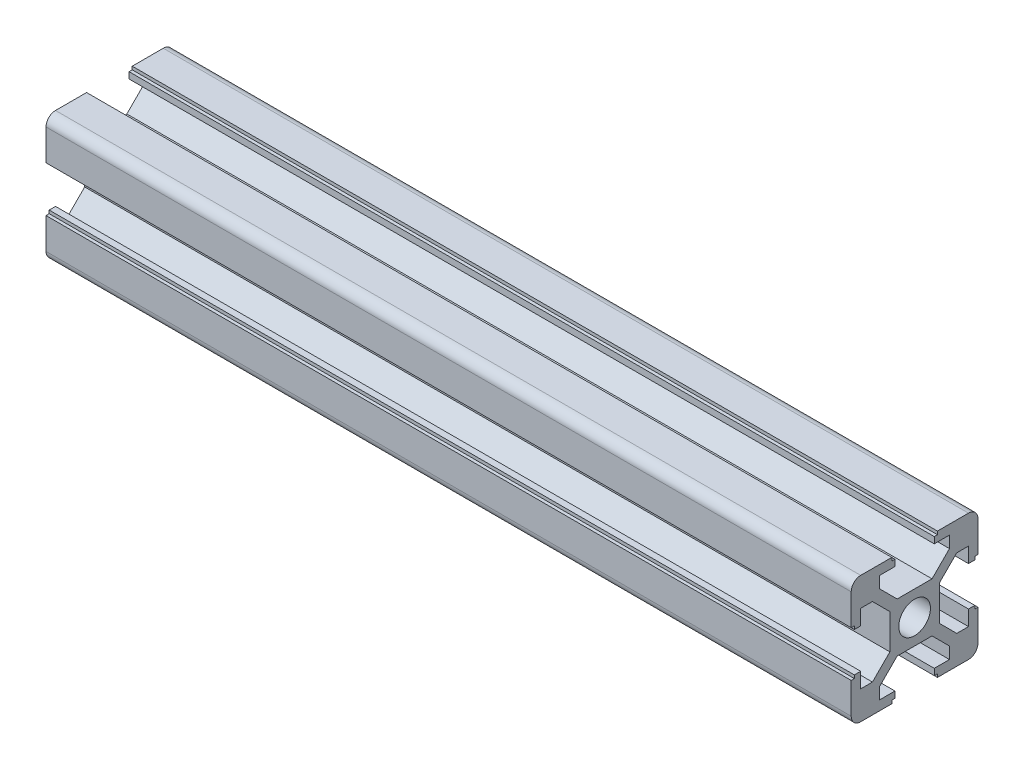
from build123d import *

# Parameters (mm, degrees)
SKETCH1_R                = 2.5
F_20_X_20_X_R1_5_1_DEPTH = 127


with BuildPart() as part:
    # Sketch1 → 铝型材 20 X 20 X R1.5(1) (new body)
    with BuildSketch(Plane(origin=(0, 0, 0), x_dir=(0, 0, -1), z_dir=(1, 0, 0))):
        with BuildLine():
            Line((-3.6, 10), (-3.6, 9.5))
            Line((-3.6, 9.5), (-3.1, 9.5))
            Line((-3.1, 9.5), (-3.1, 8.5))
            Line((-3.1, 8.5), (-5.5, 8.5))
            Line((-5.5, 8.5), (-5.5, 6.65))
            Line((-5.5, 6.65), (-2.75, 3.9))
            Line((-2.75, 3.9), (2.75, 3.9))
            Line((2.75, 3.9), (5.5, 6.65))
            Line((5.5, 6.65), (5.5, 8.5))
            Line((5.5, 8.5), (3.1, 8.5))
            Line((3.1, 8.5), (3.1, 9.5))
            Line((3.1, 9.5), (3.6, 9.5))
            Line((3.6, 9.5), (3.6, 10))
            Line((3.6, 10), (8.5, 10))
            ThreePointArc((8.5, 10), (9.560660172, 9.560660172), (10, 8.5))
            Line((10, 8.5), (10, 3.6))
            Line((10, 3.6), (9.5, 3.6))
            Line((9.5, 3.6), (9.5, 3.1))
            Line((9.5, 3.1), (8.5, 3.1))
            Line((8.5, 3.1), (8.5, 5.5))
            Line((8.5, 5.5), (6.65, 5.5))
            Line((6.65, 5.5), (3.9, 2.75))
            Line((3.9, 2.75), (3.9, -2.75))
            Line((3.9, -2.75), (6.65, -5.5))
            Line((6.65, -5.5), (8.5, -5.5))
            Line((8.5, -5.5), (8.5, -3.1))
            Line((8.5, -3.1), (9.5, -3.1))
            Line((9.5, -3.1), (9.5, -3.6))
            Line((9.5, -3.6), (10, -3.6))
            Line((10, -3.6), (10, -8.5))
            ThreePointArc((10, -8.5), (9.560660172, -9.560660172), (8.5, -10))
            Line((8.5, -10), (3.6, -10))
            Line((3.6, -10), (3.6, -9.5))
            Line((3.6, -9.5), (3.1, -9.5))
            Line((3.1, -9.5), (3.1, -8.5))
            Line((3.1, -8.5), (5.5, -8.5))
            Line((5.5, -8.5), (5.5, -6.65))
            Line((5.5, -6.65), (2.75, -3.9))
            Line((2.75, -3.9), (-2.75, -3.9))
            Line((-2.75, -3.9), (-5.5, -6.65))
            Line((-5.5, -6.65), (-5.5, -8.5))
            Line((-5.5, -8.5), (-3.1, -8.5))
            Line((-3.1, -8.5), (-3.1, -9.5))
            Line((-3.1, -9.5), (-3.6, -9.5))
            Line((-3.6, -9.5), (-3.6, -10))
            Line((-3.6, -10), (-8.5, -10))
            ThreePointArc((-8.5, -10), (-9.560660172, -9.560660172), (-10, -8.5))
            Line((-10, -8.5), (-10, -3.6))
            Line((-10, -3.6), (-9.5, -3.6))
            Line((-9.5, -3.6), (-9.5, -3.1))
            Line((-9.5, -3.1), (-8.5, -3.1))
            Line((-8.5, -3.1), (-8.5, -5.5))
            Line((-8.5, -5.5), (-6.65, -5.5))
            Line((-6.65, -5.5), (-3.9, -2.75))
            Line((-3.9, -2.75), (-3.9, 2.75))
            Line((-3.9, 2.75), (-6.65, 5.5))
            Line((-6.65, 5.5), (-8.5, 5.5))
            Line((-8.5, 5.5), (-8.5, 3.1))
            Line((-8.5, 3.1), (-9.5, 3.1))
            Line((-9.5, 3.1), (-9.5, 3.6))
            Line((-9.5, 3.6), (-10, 3.6))
            Line((-10, 3.6), (-10, 8.5))
            ThreePointArc((-10, 8.5), (-9.560660172, 9.560660172), (-8.5, 10))
            Line((-8.5, 10), (-3.6, 10))
        make_face()
        Circle(SKETCH1_R, mode=Mode.SUBTRACT)
    extrude(amount=F_20_X_20_X_R1_5_1_DEPTH)


solid = part.part
